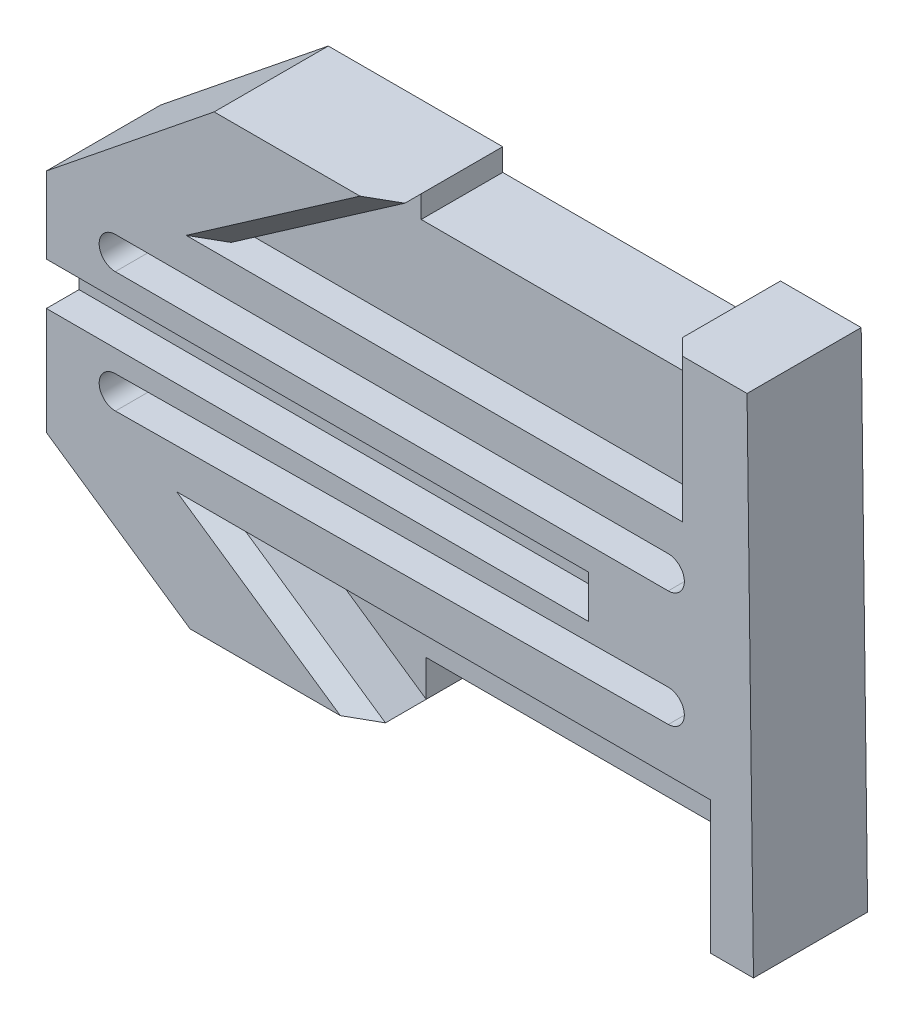
from build123d import *

# Parameters (mm, degrees)
BOSS_EXTRUDE1_DEPTH = 22.225
SKETCH2_W           = 95.09357109
SKETCH2_H           = 14.776094164
BOSS_EXTRUDE2_DEPTH = 11.1125
SKETCH3_W           = 105.533171411
SKETCH3_H           = 8.318821745
CUT_EXTRUDE1_DEPTH  = 6.35
CUT_EXTRUDE2_DEPTH  = 444.471216787
BOSS_EXTRUDE3_DEPTH = 11.1125
CHAMFER1_SIZE       = 3.175


with BuildPart() as part:
    # Sketch1 → Boss-Extrude1 (new body)
    with BuildSketch(Plane.XY):
        Polygon((219.382736593, 187.272406651), (219.382736593, 231.378695124), (252.047484341, 257.668279987), (286.011346283, 257.668279987), (286.011346283, 253.335489362), (340.095731947, 253.335489362), (340.095731947, 257.668279987), (340.095731947, 262.071092462), (355.810019244, 262.071092462), (357.059535637, 164.129151492), (345.471646064, 164.129151492), (345.471646064, 189.97898492), (250.378074974, 189.97898492), (282.230145695, 168.148416333), (247.35103376, 168.148416333), align=None)
    extrude(amount=BOSS_EXTRUDE1_DEPTH)

    # Sketch2 → Boss-Extrude2 (add)
    with BuildSketch(Plane.XY):
        with Locations((297.924860519, 182.590937838)):
            Rectangle(SKETCH2_W, SKETCH2_H)
    extrude(amount=BOSS_EXTRUDE2_DEPTH)

    # Sketch3 → Cut-Extrude1 (cut)
    with BuildSketch(Plane.XY.offset(22.225)):
        with Locations((272.149322299, 212.351794066)):
            Rectangle(SKETCH3_W, SKETCH3_H)
        Polygon((340.095731947, 253.335489362), (340.095731947, 234.12753334), (252.166996271, 234.12753334), (286.011346283, 257.668279987), align=None)
    extrude(amount=-CUT_EXTRUDE1_DEPTH, mode=Mode.SUBTRACT)

    # Sketch4 → Cut-Extrude2 (cut, through all)
    with BuildSketch(Plane.XY.offset(22.225)):
        with BuildLine():
            Line((232.799757397, 227.389091829), (340.459546105, 227.389091829))
            ThreePointArc((340.459546105, 227.389091829), (343.600105184, 224.24853275), (340.459546105, 221.107973671))
            Line((340.459546105, 221.107973671), (232.799757397, 221.107973671))
            ThreePointArc((232.799757397, 221.107973671), (229.659198318, 224.24853275), (232.799757397, 227.389091829))
        make_face()
        with BuildLine():
            Line((232.771208039, 203.900524193), (340.426548272, 204.879209104))
            ThreePointArc((340.426548272, 204.879209104), (343.595526941, 201.76732915), (340.483646987, 198.598350481))
            Line((340.483646987, 198.598350481), (232.828306754, 197.619665569))
            ThreePointArc((232.828306754, 197.619665569), (229.659328085, 200.731545524), (232.771208039, 203.900524193))
        make_face()
    extrude(amount=-CUT_EXTRUDE2_DEPTH, mode=Mode.SUBTRACT)

    # Sketch5 → Boss-Extrude3 (add)
    with BuildSketch(Plane.XY.offset(11.1125)):
        Polygon((282.230145695, 168.148416333), (282.230145695, 175.202890756), (271.937256742, 175.202890756), align=None)
    extrude(amount=-BOSS_EXTRUDE3_DEPTH)

    # Chamfer1
    chamfer1_edges = [part.edges().sort_by_distance(p)[0] for p in [
        (340.095731947, 248.099312901, 22.225),
        (345.471646064, 177.054068206, 22.225),
        (266.304110334, 179.063700626, 22.225),
        (269.089171277, 245.897906663, 22.225),
    ]]
    chamfer(chamfer1_edges, length=CHAMFER1_SIZE)


solid = part.part
